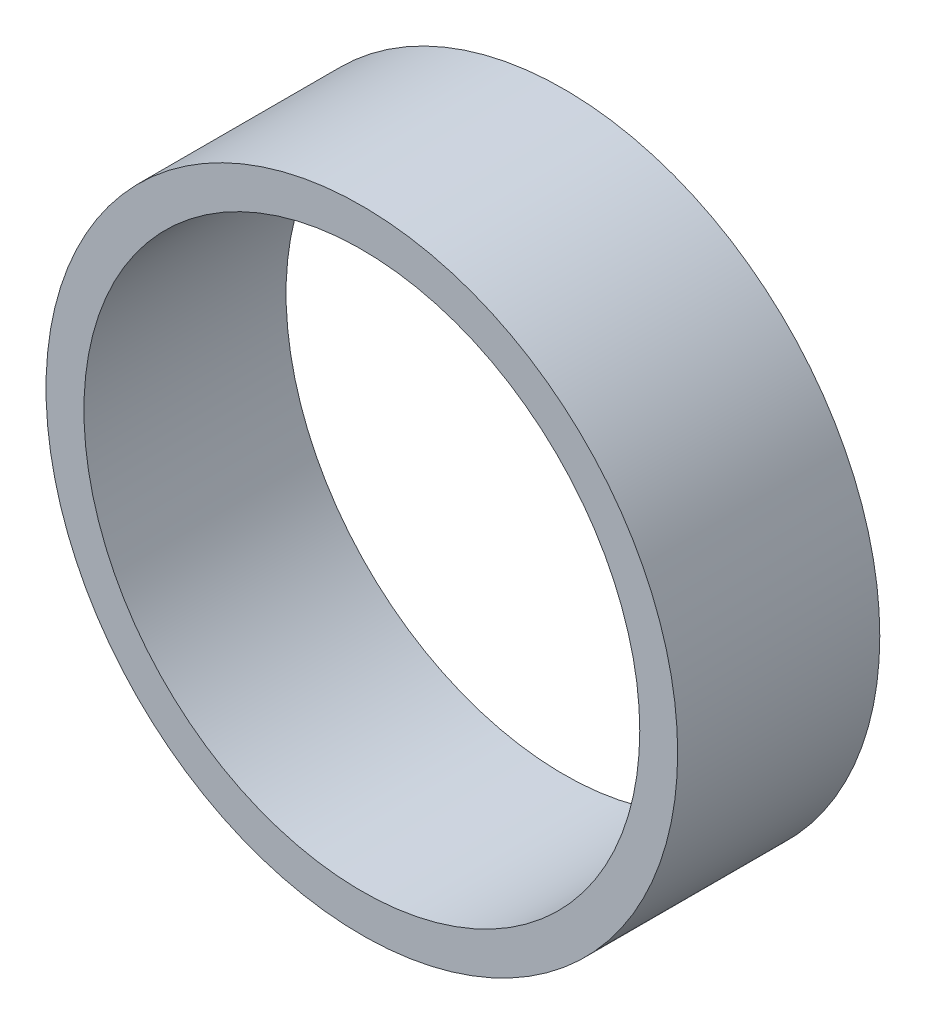
from build123d import *

# Parameters (mm, degrees)
SKETCH2_R           = 62.5
SKETCH2_R_2         = 55
BOSS_EXTRUDE1_DEPTH = 20


with BuildPart() as part:
    # Sketch2 → Boss-Extrude1 (new, symmetric)
    with BuildSketch(Plane.XY):
        Circle(SKETCH2_R)
        Circle(SKETCH2_R_2, mode=Mode.SUBTRACT)
    extrude(amount=BOSS_EXTRUDE1_DEPTH, both=True)


solid = part.part
